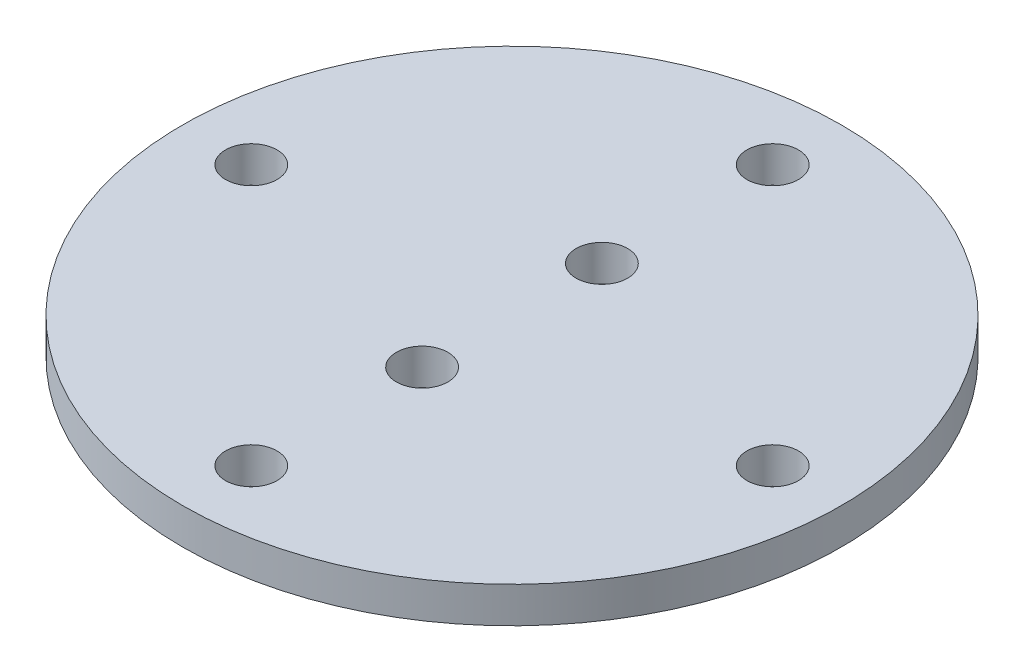
from build123d import *

# Parameters (mm, degrees)
SKETCH1_R           = 27.5
SKETCH1_R_2         = 2.15
BOSS_EXTRUDE1_DEPTH = 3


with BuildPart() as part:
    # Sketch1 → Boss-Extrude1 (new body)
    with BuildSketch(Plane(origin=(0, 0, 0), x_dir=(1, 0, 0), z_dir=(0, 1, 0))):
        with Locations(Location((0, 0, 0), (0, 0, 270))):
            Circle(SKETCH1_R)
        with Locations(Location((0, -21.754850352, 0), (0, 0, 270))):
            Circle(SKETCH1_R_2, mode=Mode.SUBTRACT)
        with Locations(Location((21.754850352, 0, 0), (0, 0, 270))):
            Circle(SKETCH1_R_2, mode=Mode.SUBTRACT)
        with Locations(Location((0, 21.754850352, 0), (0, 0, 270))):
            Circle(SKETCH1_R_2, mode=Mode.SUBTRACT)
        with Locations(Location((-21.754850352, 0, 0), (0, 0, 270))):
            Circle(SKETCH1_R_2, mode=Mode.SUBTRACT)
        with Locations(Location((0, 7.5, 0), (0, 0, 270))):
            Circle(SKETCH1_R_2, mode=Mode.SUBTRACT)
        with Locations(Location((0, -7.5, 0), (0, 0, 270))):
            Circle(SKETCH1_R_2, mode=Mode.SUBTRACT)
    extrude(amount=BOSS_EXTRUDE1_DEPTH)


solid = part.part
